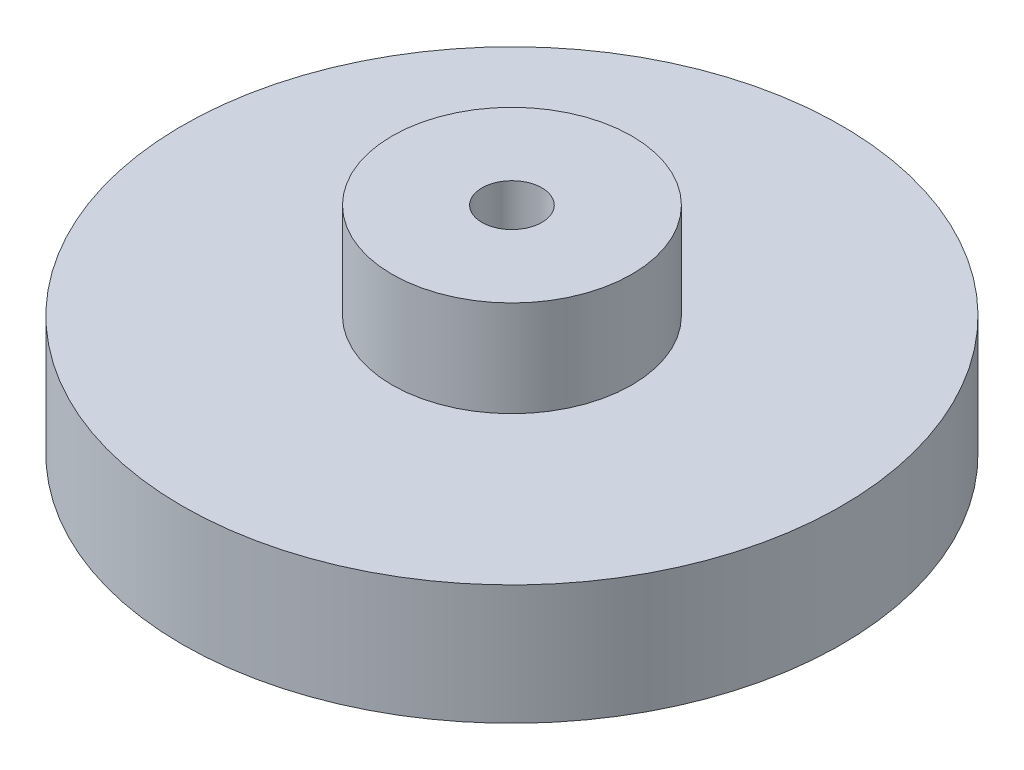
from build123d import *

# Parameters (mm, degrees)
CROQUIS1_R              = 27.5
SALIENTE_EXTRUIR1_DEPTH = 10
CROQUIS2_R              = 10
SALIENTE_EXTRUIR2_DEPTH = 8
CORTAR_EXTRUIR1_REACH   = 44.854
CROQUIS3_R              = 2.5


with BuildPart() as part:
    # Croquis1 → Saliente-Extruir1 (new body)
    with BuildSketch(Plane(origin=(0, 0, 0), x_dir=(1, 0, 0), z_dir=(0, 1, 0))):
        with Locations(Location((0, 0, 0), (0, 0, 270))):
            Circle(CROQUIS1_R)
    extrude(amount=SALIENTE_EXTRUIR1_DEPTH)

    # Croquis2 → Saliente-Extruir2 (add)
    with BuildSketch(Plane(origin=(0, 10, 0), x_dir=(1, 0, 0), z_dir=(0, 1, 0))):
        with Locations(Location((0, 0, 0), (0, 0, 270))):
            Circle(CROQUIS2_R)
    extrude(amount=SALIENTE_EXTRUIR2_DEPTH)

    # Croquis3 → Cortar-Extruir1 (cut, up to next)
    with BuildSketch(Plane(origin=(0, 18, 0), x_dir=(1, 0, 0), z_dir=(0, 1, 0)), mode=Mode.PRIVATE) as cortar_extruir1_sk1:
        with Locations(Location((0, 0, 0), (0, 0, 270))):
            Circle(CROQUIS3_R)
    cortar_extruir1_tool1 = extrude(cortar_extruir1_sk1.sketch, amount=-CORTAR_EXTRUIR1_REACH, mode=Mode.PRIVATE) & part.part
    add(cortar_extruir1_tool1.solids().sort_by_distance((0, 18, 0))[0], mode=Mode.SUBTRACT)


solid = part.part
